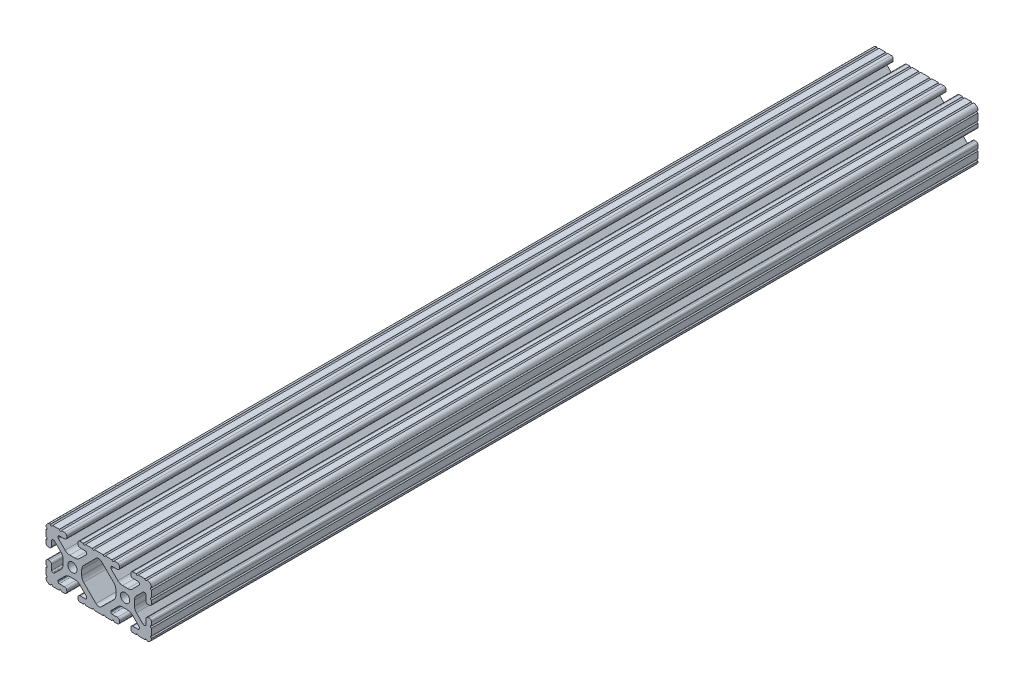
from build123d import *

# Parameters (mm, degrees)
SKETCH1_R           = 3.3274
BOSS_EXTRUDE1_DEPTH = 596.9


with BuildPart() as part:
    # Sketch1 → Boss-Extrude1 (new body)
    with BuildSketch(Plane.XY):
        with BuildLine():
            Line((38.1, -14.3256), (38.1, -9.4996))
            ThreePointArc((38.1, -9.4996), (37.338, -8.7376), (38.1, -7.9756))
            Line((38.1, -7.9756), (38.1, -5.6388))
            ThreePointArc((38.1, -5.6388), (37.638751759, -4.525248241), (36.5252, -4.064))
            Line((36.5252, -4.064), (35.6108, -4.064))
            ThreePointArc((35.6108, -4.064), (34.497248241, -4.525248241), (34.036, -5.6388))
            Line((34.036, -5.6388), (34.036, -9.398))
            ThreePointArc((34.036, -9.398), (33.775617928, -10.026617928), (33.147, -10.287))
            Line((33.147, -10.287), (32.578918, -10.287))
            ThreePointArc((32.578918, -10.287), (32.238712428, -10.219328904), (31.950300071, -10.026617928))
            Line((31.950300071, -10.026617928), (27.179198975, -5.255516832))
            ThreePointArc((27.179198975, -5.255516832), (26.14957176, -3.71457081), (25.788014764, -1.896901043))
            Line((25.788014764, -1.896901043), (25.788014764, 1.896901043))
            ThreePointArc((25.788014764, 1.896901043), (26.14957176, 3.71457081), (27.179198975, 5.255516832))
            Line((27.179198975, 5.255516832), (31.950300071, 10.026617928))
            ThreePointArc((31.950300071, 10.026617928), (32.238712428, 10.219328904), (32.578918, 10.287))
            Line((32.578918, 10.287), (33.147, 10.287))
            ThreePointArc((33.147, 10.287), (33.775617928, 10.026617928), (34.036, 9.398))
            Line((34.036, 9.398), (34.036, 5.6388))
            ThreePointArc((34.036, 5.6388), (34.497248241, 4.525248241), (35.6108, 4.064))
            Line((35.6108, 4.064), (36.5252, 4.064))
            ThreePointArc((36.5252, 4.064), (37.638751759, 4.525248241), (38.1, 5.6388))
            Line((38.1, 5.6388), (38.1, 7.9756))
            ThreePointArc((38.1, 7.9756), (37.338, 8.7376), (38.1, 9.4996))
            Line((38.1, 9.4996), (38.1, 14.3256))
            ThreePointArc((38.1, 14.3256), (37.338, 15.0876), (38.1, 15.8496))
            Line((38.1, 15.8496), (38.1, 15.875))
            ThreePointArc((38.1, 15.875), (37.17006403, 18.12006403), (34.925, 19.05))
            Line((34.925, 19.05), (34.8996, 19.05))
            ThreePointArc((34.8996, 19.05), (34.1376, 18.288), (33.3756, 19.05))
            Line((33.3756, 19.05), (28.5496, 19.05))
            ThreePointArc((28.5496, 19.05), (27.7876, 18.288), (27.0256, 19.05))
            Line((27.0256, 19.05), (24.6888, 19.05))
            ThreePointArc((24.6888, 19.05), (23.575248241, 18.588751759), (23.114, 17.4752))
            Line((23.114, 17.4752), (23.114, 16.5608))
            ThreePointArc((23.114, 16.5608), (23.575248241, 15.447248241), (24.6888, 14.986))
            Line((24.6888, 14.986), (28.448, 14.986))
            ThreePointArc((28.448, 14.986), (29.076617928, 14.725617928), (29.337, 14.097))
            Line((29.337, 14.097), (29.337, 13.528918))
            ThreePointArc((29.337, 13.528918), (29.269328904, 13.188712428), (29.076617928, 12.900300071))
            Line((29.076617928, 12.900300071), (24.305516832, 8.129198975))
            ThreePointArc((24.305516832, 8.129198975), (22.76457081, 7.09957176), (20.946901043, 6.738014764))
            Line((20.946901043, 6.738014764), (17.153098957, 6.738014764))
            ThreePointArc((17.153098957, 6.738014764), (15.33542919, 7.09957176), (13.794483168, 8.129198975))
            Line((13.794483168, 8.129198975), (9.023382072, 12.900300071))
            ThreePointArc((9.023382072, 12.900300071), (8.830671096, 13.188712428), (8.763, 13.528918))
            Line((8.763, 13.528918), (8.763, 14.097))
            ThreePointArc((8.763, 14.097), (9.023382072, 14.725617928), (9.652, 14.986))
            Line((9.652, 14.986), (13.4112, 14.986))
            ThreePointArc((13.4112, 14.986), (14.524751759, 15.447248241), (14.986, 16.5608))
            Line((14.986, 16.5608), (14.986, 17.4752))
            ThreePointArc((14.986, 17.4752), (14.524751759, 18.588751759), (13.4112, 19.05))
            Line((13.4112, 19.05), (11.0744, 19.05))
            ThreePointArc((11.0744, 19.05), (10.3124, 18.288), (9.5504, 19.05))
            Line((9.5504, 19.05), (4.7244, 19.05))
            ThreePointArc((4.7244, 19.05), (3.9624, 18.288), (3.2004, 19.05))
            Line((3.2004, 19.05), (-3.2004, 19.05))
            ThreePointArc((-3.2004, 19.05), (-3.9624, 18.288), (-4.7244, 19.05))
            Line((-4.7244, 19.05), (-9.5504, 19.05))
            ThreePointArc((-9.5504, 19.05), (-10.3124, 18.288), (-11.0744, 19.05))
            Line((-11.0744, 19.05), (-13.4112, 19.05))
            ThreePointArc((-13.4112, 19.05), (-14.524751759, 18.588751759), (-14.986, 17.4752))
            Line((-14.986, 17.4752), (-14.986, 16.5608))
            ThreePointArc((-14.986, 16.5608), (-14.524751759, 15.447248241), (-13.4112, 14.986))
            Line((-13.4112, 14.986), (-9.652, 14.986))
            ThreePointArc((-9.652, 14.986), (-9.023382072, 14.725617928), (-8.763, 14.097))
            Line((-8.763, 14.097), (-8.763, 13.528918))
            ThreePointArc((-8.763, 13.528918), (-8.830671096, 13.188712428), (-9.023382072, 12.900300071))
            Line((-9.023382072, 12.900300071), (-13.794483168, 8.129198975))
            ThreePointArc((-13.794483168, 8.129198975), (-15.33542919, 7.09957176), (-17.153098957, 6.738014764))
            Line((-17.153098957, 6.738014764), (-20.946901043, 6.738014764))
            ThreePointArc((-20.946901043, 6.738014764), (-22.76457081, 7.09957176), (-24.305516832, 8.129198975))
            Line((-24.305516832, 8.129198975), (-29.076617928, 12.900300071))
            ThreePointArc((-29.076617928, 12.900300071), (-29.269328904, 13.188712428), (-29.337, 13.528918))
            Line((-29.337, 13.528918), (-29.337, 14.097))
            ThreePointArc((-29.337, 14.097), (-29.076617928, 14.725617928), (-28.448, 14.986))
            Line((-28.448, 14.986), (-24.6888, 14.986))
            ThreePointArc((-24.6888, 14.986), (-23.575248241, 15.447248241), (-23.114, 16.5608))
            Line((-23.114, 16.5608), (-23.114, 17.4752))
            ThreePointArc((-23.114, 17.4752), (-23.575248241, 18.588751759), (-24.6888, 19.05))
            Line((-24.6888, 19.05), (-27.0256, 19.05))
            ThreePointArc((-27.0256, 19.05), (-27.7876, 18.288), (-28.5496, 19.05))
            Line((-28.5496, 19.05), (-33.3756, 19.05))
            ThreePointArc((-33.3756, 19.05), (-34.1376, 18.288), (-34.8996, 19.05))
            Line((-34.8996, 19.05), (-34.925, 19.05))
            ThreePointArc((-34.925, 19.05), (-37.17006403, 18.12006403), (-38.1, 15.875))
            Line((-38.1, 15.875), (-38.1, 15.8496))
            ThreePointArc((-38.1, 15.8496), (-37.338, 15.0876), (-38.1, 14.3256))
            Line((-38.1, 14.3256), (-38.1, 9.4996))
            ThreePointArc((-38.1, 9.4996), (-37.338, 8.7376), (-38.1, 7.9756))
            Line((-38.1, 7.9756), (-38.1, 5.6388))
            ThreePointArc((-38.1, 5.6388), (-37.638751759, 4.525248241), (-36.5252, 4.064))
            Line((-36.5252, 4.064), (-35.6108, 4.064))
            ThreePointArc((-35.6108, 4.064), (-34.497248241, 4.525248241), (-34.036, 5.6388))
            Line((-34.036, 5.6388), (-34.036, 9.398))
            ThreePointArc((-34.036, 9.398), (-33.775617928, 10.026617928), (-33.147, 10.287))
            Line((-33.147, 10.287), (-32.578918, 10.287))
            ThreePointArc((-32.578918, 10.287), (-32.238712428, 10.219328904), (-31.950300071, 10.026617928))
            Line((-31.950300071, 10.026617928), (-27.179198975, 5.255516832))
            ThreePointArc((-27.179198975, 5.255516832), (-26.14957176, 3.71457081), (-25.788014764, 1.896901043))
            Line((-25.788014764, 1.896901043), (-25.788014764, -1.896901043))
            ThreePointArc((-25.788014764, -1.896901043), (-26.14957176, -3.71457081), (-27.179198975, -5.255516832))
            Line((-27.179198975, -5.255516832), (-31.950300071, -10.026617928))
            ThreePointArc((-31.950300071, -10.026617928), (-32.238712428, -10.219328904), (-32.578918, -10.287))
            Line((-32.578918, -10.287), (-33.147, -10.287))
            ThreePointArc((-33.147, -10.287), (-33.775617928, -10.026617928), (-34.036, -9.398))
            Line((-34.036, -9.398), (-34.036, -5.6388))
            ThreePointArc((-34.036, -5.6388), (-34.497248241, -4.525248241), (-35.6108, -4.064))
            Line((-35.6108, -4.064), (-36.5252, -4.064))
            ThreePointArc((-36.5252, -4.064), (-37.638751759, -4.525248241), (-38.1, -5.6388))
            Line((-38.1, -5.6388), (-38.1, -7.9756))
            ThreePointArc((-38.1, -7.9756), (-37.338, -8.7376), (-38.1, -9.4996))
            Line((-38.1, -9.4996), (-38.1, -14.3256))
            ThreePointArc((-38.1, -14.3256), (-37.338, -15.0876), (-38.1, -15.8496))
            Line((-38.1, -15.8496), (-38.1, -15.875))
            ThreePointArc((-38.1, -15.875), (-37.17006403, -18.12006403), (-34.925, -19.05))
            Line((-34.925, -19.05), (-34.8996, -19.05))
            ThreePointArc((-34.8996, -19.05), (-34.1376, -18.288), (-33.3756, -19.05))
            Line((-33.3756, -19.05), (-28.5496, -19.05))
            ThreePointArc((-28.5496, -19.05), (-27.7876, -18.288), (-27.0256, -19.05))
            Line((-27.0256, -19.05), (-24.6888, -19.05))
            ThreePointArc((-24.6888, -19.05), (-23.575248241, -18.588751759), (-23.114, -17.4752))
            Line((-23.114, -17.4752), (-23.114, -16.5608))
            ThreePointArc((-23.114, -16.5608), (-23.575248241, -15.447248241), (-24.6888, -14.986))
            Line((-24.6888, -14.986), (-28.448, -14.986))
            ThreePointArc((-28.448, -14.986), (-29.076617928, -14.725617928), (-29.337, -14.097))
            Line((-29.337, -14.097), (-29.337, -13.528918))
            ThreePointArc((-29.337, -13.528918), (-29.269328904, -13.188712428), (-29.076617928, -12.900300071))
            Line((-29.076617928, -12.900300071), (-24.305516832, -8.129198975))
            ThreePointArc((-24.305516832, -8.129198975), (-22.76457081, -7.09957176), (-20.946901043, -6.738014764))
            Line((-20.946901043, -6.738014764), (-17.153098957, -6.738014764))
            ThreePointArc((-17.153098957, -6.738014764), (-15.33542919, -7.09957176), (-13.794483168, -8.129198975))
            Line((-13.794483168, -8.129198975), (-9.023382072, -12.900300071))
            ThreePointArc((-9.023382072, -12.900300071), (-8.830671096, -13.188712428), (-8.763, -13.528918))
            Line((-8.763, -13.528918), (-8.763, -14.097))
            ThreePointArc((-8.763, -14.097), (-9.023382072, -14.725617928), (-9.652, -14.986))
            Line((-9.652, -14.986), (-13.4112, -14.986))
            ThreePointArc((-13.4112, -14.986), (-14.524751759, -15.447248241), (-14.986, -16.5608))
            Line((-14.986, -16.5608), (-14.986, -17.4752))
            ThreePointArc((-14.986, -17.4752), (-14.524751759, -18.588751759), (-13.4112, -19.05))
            Line((-13.4112, -19.05), (-11.0744, -19.05))
            ThreePointArc((-11.0744, -19.05), (-10.3124, -18.288), (-9.5504, -19.05))
            Line((-9.5504, -19.05), (-4.7244, -19.05))
            ThreePointArc((-4.7244, -19.05), (-3.9624, -18.288), (-3.2004, -19.05))
            Line((-3.2004, -19.05), (3.2004, -19.05))
            ThreePointArc((3.2004, -19.05), (3.9624, -18.288), (4.7244, -19.05))
            Line((4.7244, -19.05), (9.5504, -19.05))
            ThreePointArc((9.5504, -19.05), (10.3124, -18.288), (11.0744, -19.05))
            Line((11.0744, -19.05), (13.4112, -19.05))
            ThreePointArc((13.4112, -19.05), (14.524751759, -18.588751759), (14.986, -17.4752))
            Line((14.986, -17.4752), (14.986, -16.5608))
            ThreePointArc((14.986, -16.5608), (14.524751759, -15.447248241), (13.4112, -14.986))
            Line((13.4112, -14.986), (9.652, -14.986))
            ThreePointArc((9.652, -14.986), (9.023382072, -14.725617928), (8.763, -14.097))
            Line((8.763, -14.097), (8.763, -13.528918))
            ThreePointArc((8.763, -13.528918), (8.830671096, -13.188712428), (9.023382072, -12.900300071))
            Line((9.023382072, -12.900300071), (13.794483168, -8.129198975))
            ThreePointArc((13.794483168, -8.129198975), (15.33542919, -7.09957176), (17.153098957, -6.738014764))
            Line((17.153098957, -6.738014764), (20.946901043, -6.738014764))
            ThreePointArc((20.946901043, -6.738014764), (22.76457081, -7.09957176), (24.305516832, -8.129198975))
            Line((24.305516832, -8.129198975), (29.076617928, -12.900300071))
            ThreePointArc((29.076617928, -12.900300071), (29.269328904, -13.188712428), (29.337, -13.528918))
            Line((29.337, -13.528918), (29.337, -14.097))
            ThreePointArc((29.337, -14.097), (29.076617928, -14.725617928), (28.448, -14.986))
            Line((28.448, -14.986), (24.6888, -14.986))
            ThreePointArc((24.6888, -14.986), (23.575248241, -15.447248241), (23.114, -16.5608))
            Line((23.114, -16.5608), (23.114, -17.4752))
            ThreePointArc((23.114, -17.4752), (23.575248241, -18.588751759), (24.6888, -19.05))
            Line((24.6888, -19.05), (27.0256, -19.05))
            ThreePointArc((27.0256, -19.05), (27.7876, -18.288), (28.5496, -19.05))
            Line((28.5496, -19.05), (33.3756, -19.05))
            ThreePointArc((33.3756, -19.05), (34.1376, -18.288), (34.8996, -19.05))
            Line((34.8996, -19.05), (34.925, -19.05))
            ThreePointArc((34.925, -19.05), (37.17006403, -18.12006403), (38.1, -15.875))
            Line((38.1, -15.875), (38.1, -15.8496))
            ThreePointArc((38.1, -15.8496), (37.338, -15.0876), (38.1, -14.3256))
        make_face()
        with Locations((19.05, 0)):
            Circle(SKETCH1_R, mode=Mode.SUBTRACT)
        with Locations((-19.05, 0)):
            Circle(SKETCH1_R, mode=Mode.SUBTRACT)
        with BuildLine():
            Line((-12.31198542, -1.896901043), (-12.31198542, 1.896901043))
            ThreePointArc((-12.31198542, 1.896901043), (-11.950428424, 3.71457081), (-10.920801209, 5.255516832))
            Line((-10.920801209, 5.255516832), (-2.065458908, 14.110859133))
            ThreePointArc((-2.065458908, 14.110859133), (0, 14.966400226), (2.065458908, 14.110859133))
            Line((2.065458908, 14.110859133), (10.920801209, 5.255516832))
            ThreePointArc((10.920801209, 5.255516832), (11.950428424, 3.71457081), (12.31198542, 1.896901043))
            Line((12.31198542, 1.896901043), (12.31198542, -1.896901043))
            ThreePointArc((12.31198542, -1.896901043), (11.950428424, -3.71457081), (10.920801209, -5.255516832))
            Line((10.920801209, -5.255516832), (2.065458908, -14.110859133))
            ThreePointArc((2.065458908, -14.110859133), (0, -14.966400226), (-2.065458908, -14.110859133))
            Line((-2.065458908, -14.110859133), (-10.920801209, -5.255516832))
            ThreePointArc((-10.920801209, -5.255516832), (-11.950428424, -3.71457081), (-12.31198542, -1.896901043))
        make_face(mode=Mode.SUBTRACT)
    extrude(amount=BOSS_EXTRUDE1_DEPTH)


solid = part.part
